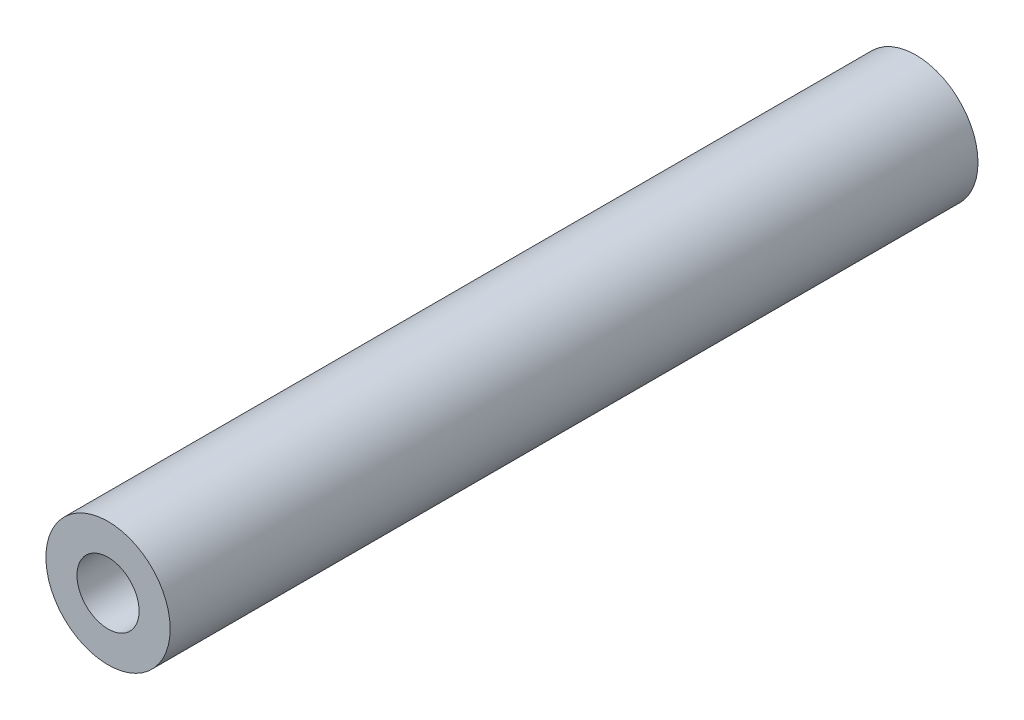
from build123d import *

# Parameters (mm, degrees)
SKETCH1_R           = 5
SKETCH1_R_2         = 2.5
BOSS_EXTRUDE1_DEPTH = 65


with BuildPart() as part:
    # Sketch1 → Boss-Extrude1 (new body)
    with BuildSketch(Plane.XY):
        Circle(SKETCH1_R)
        Circle(SKETCH1_R_2, mode=Mode.SUBTRACT)
    extrude(amount=BOSS_EXTRUDE1_DEPTH)


solid = part.part
